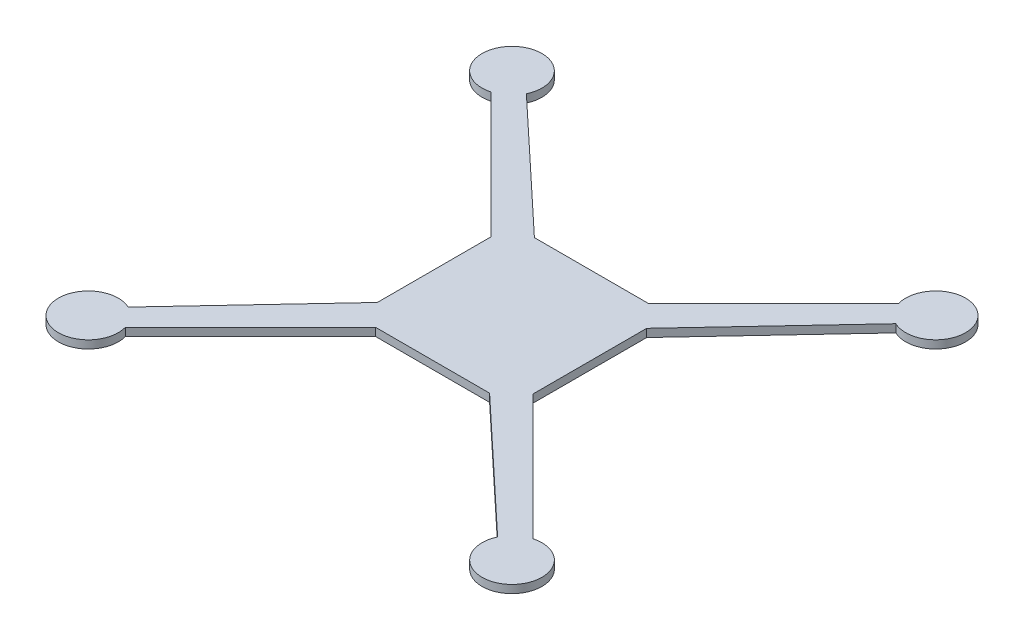
from build123d import *

# Parameters (mm, degrees)
EXTRUDE_1_DEPTH = 4


with BuildPart() as part:
    # 草图1 → 凸台-拉伸1 (new body)
    with BuildSketch(Plane(origin=(0, 0, 0), x_dir=(1, 0, 0), z_dir=(0, 1, 0))):
        with BuildLine():
            Line((28.10762521, -39.327328189), (-28.937020053, -39.327328189))
            Line((-28.937020053, -39.327328189), (-91.623681149, -102.013989286))
            ThreePointArc((-91.623681149, -102.013989286), (-117.513377544, -115.759207605), (-99.689043689, -92.489043689))
            Line((-99.689043689, -92.489043689), (-39.327328189, -28.10762521))
            Line((-39.327328189, -28.10762521), (-39.327328189, 28.937020053))
            Line((-39.327328189, 28.937020053), (-102.013989286, 91.623681149))
            ThreePointArc((-102.013989286, 91.623681149), (-115.759207605, 117.513377544), (-92.489043689, 99.689043689))
            Line((-92.489043689, 99.689043689), (-28.10762521, 39.327328189))
            Line((-28.10762521, 39.327328189), (28.937020053, 39.327328189))
            Line((28.937020053, 39.327328189), (91.623681149, 102.013989286))
            ThreePointArc((91.623681149, 102.013989286), (117.513377544, 115.759207605), (99.689043689, 92.489043689))
            Line((99.689043689, 92.489043689), (39.327328189, 28.10762521))
            Line((39.327328189, 28.10762521), (39.327328189, -28.937020053))
            Line((39.327328189, -28.937020053), (102.013989286, -91.623681149))
            ThreePointArc((102.013989286, -91.623681149), (115.759207605, -117.513377544), (92.489043689, -99.689043689))
            Line((92.489043689, -99.689043689), (28.10762521, -39.327328189))
        make_face()
    extrude(amount=EXTRUDE_1_DEPTH)


solid = part.part
